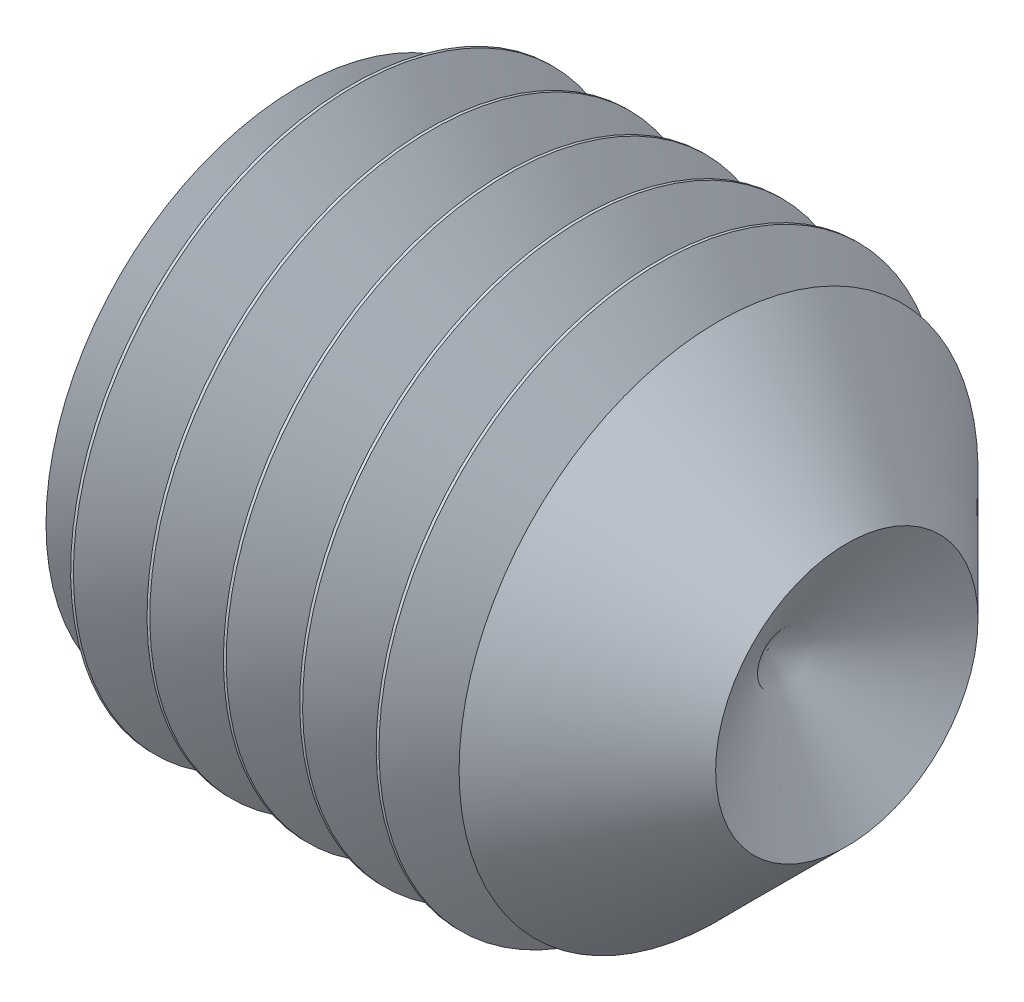
from build123d import *

# Parameters (mm, degrees)
HEX_2_DEPTH     = 1.5
THDSCHPAT_COUNT = 6
THDSCHPAT_PITCH = 0.407610675


with BuildPart() as part:
    # BodySke → BaseBody (revolve)
    with BuildSketch(Plane.XY, mode=Mode.PRIVATE) as basebody_sk:
        Polygon((0, 0), (0, 1.2195), (0.161946751, 1.5), (2.2, 1.5), (3, 0.7), (2.579397567, 0), align=None)
    revolve(basebody_sk.sketch.rotate(Axis((-12.7, 0, 0), (1, 0, 0)), 90), axis=Axis((-12.7, 0, 0), (1, 0, 0)))

    # Sketch2 → Hex 2 (cut)
    with BuildSketch(Plane.ZY):
        Polygon((0.433012702, 0.75), (-0.433012702, 0.75), (-0.866025404, 0), (-0.433012702, -0.75), (0.433012702, -0.75), (0.866025404, 0), align=None)
    extrude(amount=-HEX_2_DEPTH, mode=Mode.SUBTRACT)

    # ThdSchSke → ThreadSchematic (revolve, cut)
    with BuildSketch(Plane.XY):
        Polygon((0.161946751, -1.2195), (-0.034461464, -1.5), (-0.034461464, -1.875), (0.358354965, -1.875), (0.358354965, -1.5), align=None)
    threadschematic = revolve(axis=Axis((-3.175, 0, 0), (1, 0, 0)), mode=Mode.SUBTRACT)

    # ThdSchPat: ThreadSchematic ×6
    with Locations(*[(i * THDSCHPAT_PITCH, 0, 0) for i in range(1, THDSCHPAT_COUNT)]):
        add(threadschematic, mode=Mode.SUBTRACT)


solid = part.part
